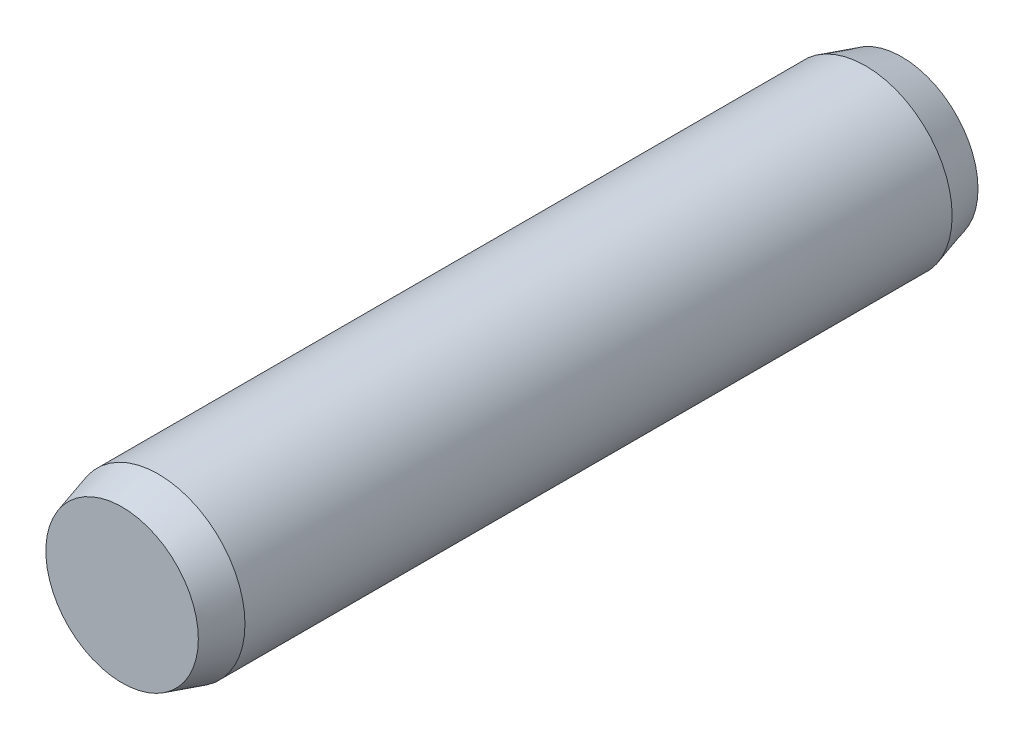
from build123d import *


with BuildPart() as part:
    # Sketch3 → Revolve1 (revolve)
    with BuildSketch(Plane(origin=(0, 0, 0), x_dir=(0, 0, -1), z_dir=(1, 0, 0)), mode=Mode.PRIVATE) as revolve1_sk:
        Polygon((-7.14375, 0), (7.14375, 0), (7.14375, 1.397), (6.479397548, 1.5875), (-6.479397548, 1.5875), (-7.14375, 1.397), align=None)
    revolve(revolve1_sk.sketch.rotate(Axis((0, 0, 7.14375), (0, 0, -1)), 90), axis=Axis((0, 0, 7.14375), (0, 0, -1)))


solid = part.part
